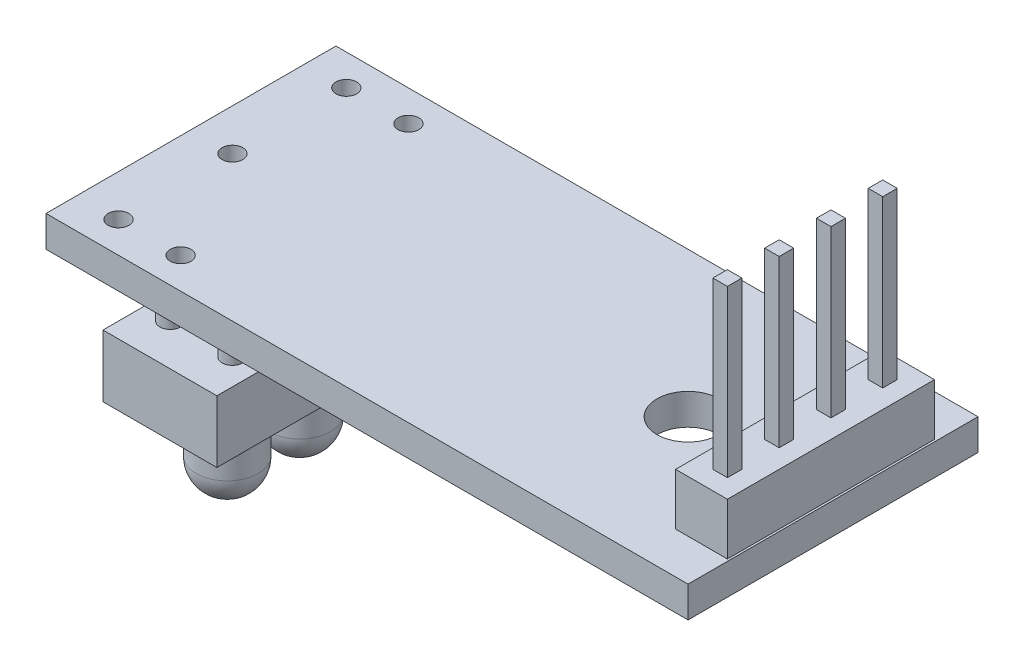
from build123d import *

# Parameters (mm, degrees)
SKETCH1_W            = 31
SKETCH1_H            = 14
SKETCH1_R            = 1.5
BOSS_EXTRUDE1_DEPTH  = 1.5
SKETCH2_W            = 2.5
SKETCH2_H            = 10
BOSS_EXTRUDE2_DEPTH  = 2.5
SKETCH3_W            = 0.7
SKETCH3_H            = 0.7
BOSS_EXTRUDE3_DEPTH  = 8
CUT_EXTRUDE3_REACH   = 37.598
SKETCH13_R           = 0.5
SKETCH14_W           = 10
SKETCH14_H           = 5.5
BOSS_EXTRUDE10_DEPTH = 4
CHAMFER1_SIZE        = 1
SKETCH15_R           = 1.5
BOSS_EXTRUDE11_DEPTH = 3
SKETCH15_2_R         = 1.5
BOSS_EXTRUDE12_DEPTH = 2
FILLET3_R            = 1.5
FILLET4_R            = 1.5
BOSS_EXTRUDE13_START = -5.5
SKETCH16_R           = 0.5
BOSS_EXTRUDE13_DEPTH = 5.5


with BuildPart() as part:
    # Sketch1 → Boss-Extrude1 (new body)
    with BuildSketch(Plane(origin=(0, 0, 0), x_dir=(1, 0, 0), z_dir=(0, 1, 0))):
        with Locations((-15.5, -7)):
            Rectangle(SKETCH1_W, SKETCH1_H)
        with Locations((-7, -7)):
            Circle(SKETCH1_R, mode=Mode.SUBTRACT)
    extrude(amount=BOSS_EXTRUDE1_DEPTH)

    # Sketch2 → Boss-Extrude2 (add)
    with BuildSketch(Plane(origin=(0, 1.5, 0), x_dir=(1, 0, 0), z_dir=(0, 1, 0))):
        with Locations((-1.35, -7)):
            Rectangle(SKETCH2_W, SKETCH2_H)
    extrude(amount=BOSS_EXTRUDE2_DEPTH)

    # Sketch3 → Boss-Extrude3 (add)
    with BuildSketch(Plane(origin=(0, 4, 0), x_dir=(1, 0, 0), z_dir=(0, 1, 0))):
        with Locations((-1.35, -3.25)):
            Rectangle(SKETCH3_W, SKETCH3_H)
        with Locations((-1.35, -5.75)):
            Rectangle(SKETCH3_W, SKETCH3_H)
        with Locations((-1.35, -8.25)):
            Rectangle(SKETCH3_W, SKETCH3_H)
        with Locations((-1.35, -10.75)):
            Rectangle(SKETCH3_W, SKETCH3_H)
    extrude(amount=BOSS_EXTRUDE3_DEPTH)

    # Sketch13 → Cut-Extrude3 (cut, up to next)
    with BuildSketch(Plane.ZX.offset(1.5), mode=Mode.PRIVATE) as cut_extrude3_sk1:
        with Locations((12.5, -29)):
            Circle(SKETCH13_R)
    cut_extrude3_tool1 = extrude(cut_extrude3_sk1.sketch, amount=-CUT_EXTRUDE3_REACH, mode=Mode.PRIVATE) & part.part
    # Sketch13 → Cut-Extrude3 (cut, up to next)
    with BuildSketch(Plane.ZX.offset(1.5), mode=Mode.PRIVATE) as cut_extrude3_sk2:
        with Locations((12.5, -26)):
            Circle(SKETCH13_R)
    cut_extrude3_tool2 = extrude(cut_extrude3_sk2.sketch, amount=-CUT_EXTRUDE3_REACH, mode=Mode.PRIVATE) & part.part
    # Sketch13 → Cut-Extrude3 (cut, up to next)
    with BuildSketch(Plane.ZX.offset(1.5), mode=Mode.PRIVATE) as cut_extrude3_sk3:
        with Locations((10, -26)):
            Circle(SKETCH13_R)
    cut_extrude3_tool3 = extrude(cut_extrude3_sk3.sketch, amount=-CUT_EXTRUDE3_REACH, mode=Mode.PRIVATE) & part.part
    # Sketch13 → Cut-Extrude3 (cut, up to next)
    with BuildSketch(Plane.ZX.offset(1.5), mode=Mode.PRIVATE) as cut_extrude3_sk4:
        with Locations((10, -29)):
            Circle(SKETCH13_R)
    cut_extrude3_tool4 = extrude(cut_extrude3_sk4.sketch, amount=-CUT_EXTRUDE3_REACH, mode=Mode.PRIVATE) & part.part
    # Sketch13 → Cut-Extrude3 (cut, up to next)
    with BuildSketch(Plane.ZX.offset(1.5), mode=Mode.PRIVATE) as cut_extrude3_sk5:
        with Locations((7, -29)):
            Circle(SKETCH13_R)
    cut_extrude3_tool5 = extrude(cut_extrude3_sk5.sketch, amount=-CUT_EXTRUDE3_REACH, mode=Mode.PRIVATE) & part.part
    # Sketch13 → Cut-Extrude3 (cut, up to next)
    with BuildSketch(Plane.ZX.offset(1.5), mode=Mode.PRIVATE) as cut_extrude3_sk6:
        with Locations((4, -29)):
            Circle(SKETCH13_R)
    cut_extrude3_tool6 = extrude(cut_extrude3_sk6.sketch, amount=-CUT_EXTRUDE3_REACH, mode=Mode.PRIVATE) & part.part
    # Sketch13 → Cut-Extrude3 (cut, up to next)
    with BuildSketch(Plane.ZX.offset(1.5), mode=Mode.PRIVATE) as cut_extrude3_sk7:
        with Locations((1.5, -29)):
            Circle(SKETCH13_R)
    cut_extrude3_tool7 = extrude(cut_extrude3_sk7.sketch, amount=-CUT_EXTRUDE3_REACH, mode=Mode.PRIVATE) & part.part
    # Sketch13 → Cut-Extrude3 (cut, up to next)
    with BuildSketch(Plane.ZX.offset(1.5), mode=Mode.PRIVATE) as cut_extrude3_sk8:
        with Locations((4, -26)):
            Circle(SKETCH13_R)
    cut_extrude3_tool8 = extrude(cut_extrude3_sk8.sketch, amount=-CUT_EXTRUDE3_REACH, mode=Mode.PRIVATE) & part.part
    # Sketch13 → Cut-Extrude3 (cut, up to next)
    with BuildSketch(Plane.ZX.offset(1.5), mode=Mode.PRIVATE) as cut_extrude3_sk9:
        with Locations((1.5, -26)):
            Circle(SKETCH13_R)
    cut_extrude3_tool9 = extrude(cut_extrude3_sk9.sketch, amount=-CUT_EXTRUDE3_REACH, mode=Mode.PRIVATE) & part.part
    add(cut_extrude3_tool1.solids().sort_by_distance((-29, 1.5, 12.5))[0], mode=Mode.SUBTRACT)
    add(cut_extrude3_tool2.solids().sort_by_distance((-26, 1.5, 12.5))[0], mode=Mode.SUBTRACT)
    add(cut_extrude3_tool3.solids().sort_by_distance((-26, 1.5, 10))[0], mode=Mode.SUBTRACT)
    add(cut_extrude3_tool4.solids().sort_by_distance((-29, 1.5, 10))[0], mode=Mode.SUBTRACT)
    add(cut_extrude3_tool5.solids().sort_by_distance((-29, 1.5, 7))[0], mode=Mode.SUBTRACT)
    add(cut_extrude3_tool6.solids().sort_by_distance((-29, 1.5, 4))[0], mode=Mode.SUBTRACT)
    add(cut_extrude3_tool7.solids().sort_by_distance((-29, 1.5, 1.5))[0], mode=Mode.SUBTRACT)
    add(cut_extrude3_tool8.solids().sort_by_distance((-26, 1.5, 4))[0], mode=Mode.SUBTRACT)
    add(cut_extrude3_tool9.solids().sort_by_distance((-26, 1.5, 1.5))[0], mode=Mode.SUBTRACT)

    # Sketch16 → Boss-Extrude13 (add)
    with BuildSketch(Plane(origin=(0, -4, 0), x_dir=(0, 0, -1), z_dir=(0, -1, 0)).offset(BOSS_EXTRUDE13_START)):
        with Locations((-10, -26)):
            Circle(SKETCH16_R)
        with Locations((-4, -29)):
            Circle(SKETCH16_R)
        with Locations((-4, -26)):
            Circle(SKETCH16_R)
        with Locations((-10, -29)):
            Circle(SKETCH16_R)
    extrude(amount=BOSS_EXTRUDE13_DEPTH)


with BuildPart() as body_2:
    # Sketch14 → Boss-Extrude10 (new body)
    with BuildSketch(Plane(origin=(0, -4, 0), x_dir=(0, 0, -1), z_dir=(0, -1, 0))):
        with Locations((-7, -27.5)):
            Rectangle(SKETCH14_W, SKETCH14_H)
    extrude(amount=BOSS_EXTRUDE10_DEPTH)

    # Chamfer1
    chamfer1_edges = [body_2.edges().sort_by_distance(p)[0] for p in [
        (-27.5, -8, 2),
        (-30.25, -8, 7),
        (-27.5, -8, 12),
        (-24.75, -8, 7),
    ]]
    chamfer(chamfer1_edges, length=CHAMFER1_SIZE)

    # Sketch15 → Boss-Extrude11 (add)
    with BuildSketch(Plane(origin=(0, -8, 0), x_dir=(0, 0, -1), z_dir=(0, -1, 0))):
        with Locations((-8.75, -27.5)):
            Circle(SKETCH15_R)
        with Locations((-5.25, -27.5)):
            Circle(SKETCH15_R)
    extrude(amount=BOSS_EXTRUDE11_DEPTH)

    # Sketch15<2> → Boss-Extrude12 (add)
    with BuildSketch(Plane(origin=(0, -8, 0), x_dir=(0, 0, -1), z_dir=(0, -1, 0))):
        with Locations((-8.75, -27.5)):
            Circle(SKETCH15_2_R)
        with Locations((-5.25, -27.5)):
            Circle(SKETCH15_2_R)
    extrude(amount=-BOSS_EXTRUDE12_DEPTH)

    # Fillet3
    fillet3_edges = [body_2.edges().sort_by_distance(p)[0] for p in [
        (-27.5, -11, 10.25),
    ]]
    fillet(fillet3_edges, radius=FILLET3_R)

    # Fillet4
    fillet4_edges = [body_2.edges().sort_by_distance(p)[0] for p in [
        (-27.5, -11, 6.75),
    ]]
    fillet(fillet4_edges, radius=FILLET4_R)


solid = Compound([part.part, body_2.part])
